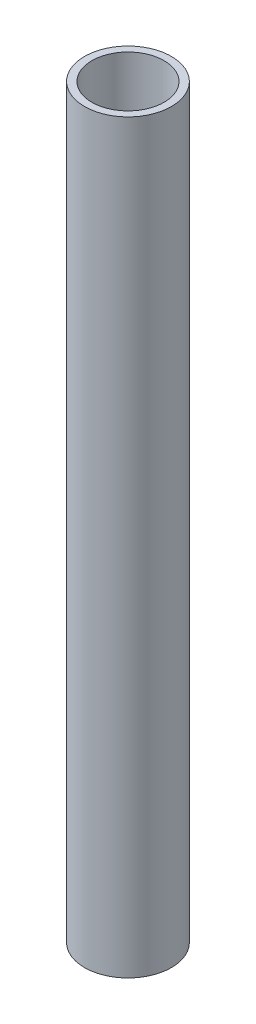
from build123d import *

# Parameters (mm, degrees)
SKETCH1_R           = 21.082
SKETCH1_R_2         = 17.526
BOSS_EXTRUDE1_DEPTH = 361.95


with BuildPart() as part:
    # Sketch1 → Boss-Extrude1 (new body)
    with BuildSketch(Plane(origin=(0, 0, 0), x_dir=(1, 0, 0), z_dir=(0, 1, 0))):
        with Locations(Location((0, 0, 0), (0, 0, 270))):
            Circle(SKETCH1_R)
        with Locations(Location((0, 0, 0), (0, 0, 270))):
            Circle(SKETCH1_R_2, mode=Mode.SUBTRACT)
    extrude(amount=BOSS_EXTRUDE1_DEPTH)


solid = part.part
